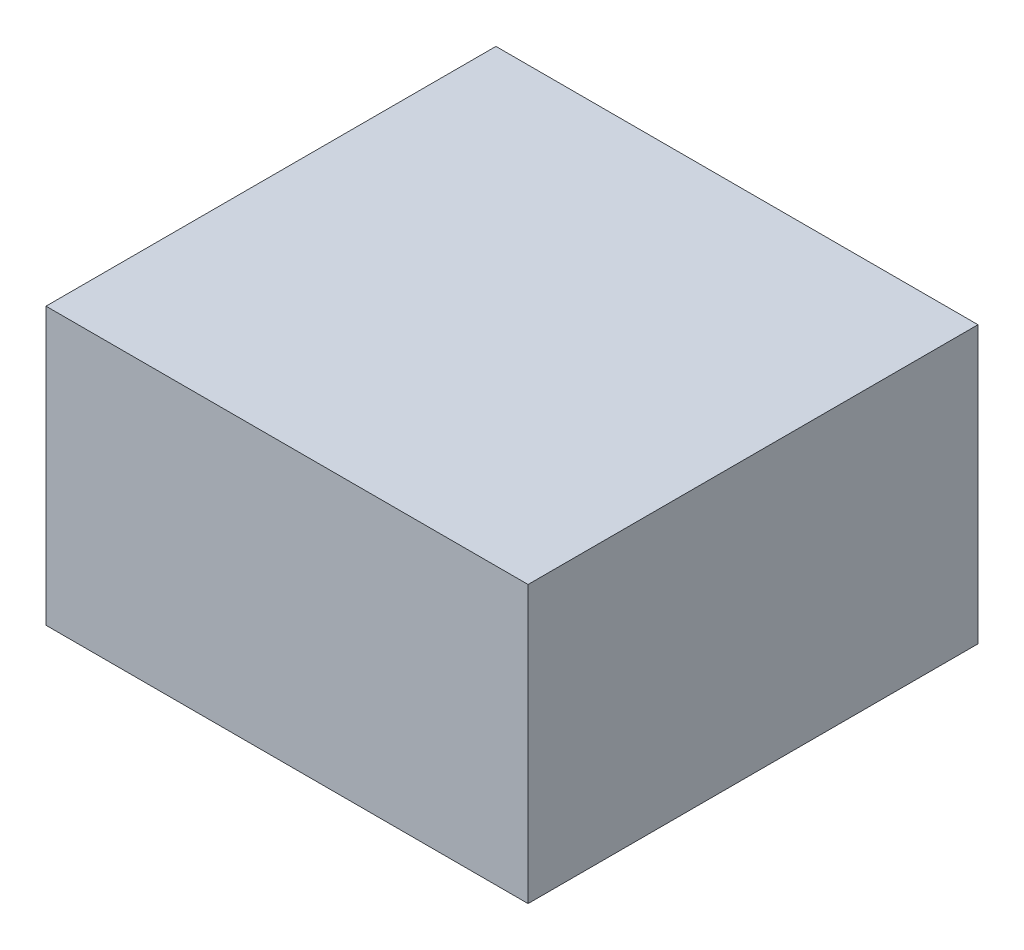
from build123d import *

# Parameters (mm, degrees)
SKETCH_1_W      = 150
SKETCH_1_H      = 86
EXTRUDE_1_DEPTH = 140


with BuildPart() as part:
    # Эскиз1 → Бобышка-Вытянуть1 (new body)
    with BuildSketch(Plane.XY):
        with Locations((75, 43)):
            Rectangle(SKETCH_1_W, SKETCH_1_H)
    extrude(amount=EXTRUDE_1_DEPTH)


solid = part.part
